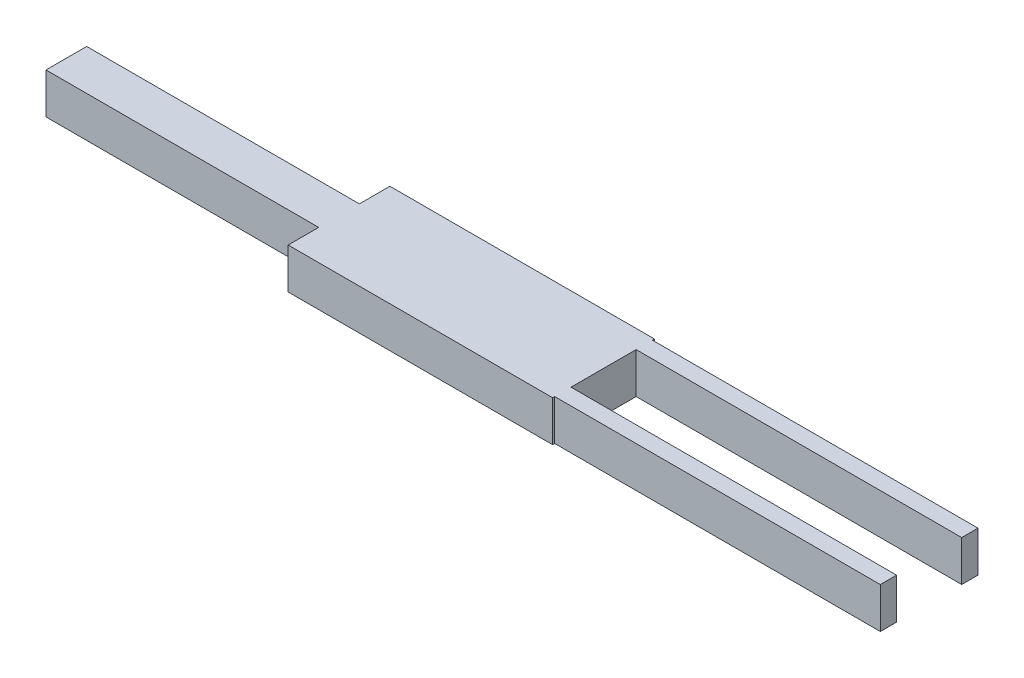
from build123d import *

# Parameters (mm, degrees)
BOSS_EXTRUDE1_DEPTH = 10


with BuildPart() as part:
    # Sketch1 → Boss-Extrude1 (new body)
    with BuildSketch(Plane(origin=(0, 0, 0), x_dir=(1, 0, 0), z_dir=(0, 1, 0))):
        Polygon((251.197875898, 10.186414256), (171.197875898, 10.186414256), (171.197875898, -5.813585744), (251.197875898, -5.813585744), (251.197875898, -9.813585744), (171.197875898, -9.813585744), (171.197875898, -10.313585744), (106.197875898, -10.313585744), (106.197875898, -2.813585744), (39.197875898, -2.813585744), (39.197875898, 7.186414256), (106.197875898, 7.186414256), (106.197875898, 14.686414256), (171.197875898, 14.686414256), (171.197875898, 14.186414256), (251.197875898, 14.186414256), align=None)
    extrude(amount=BOSS_EXTRUDE1_DEPTH)


solid = part.part
